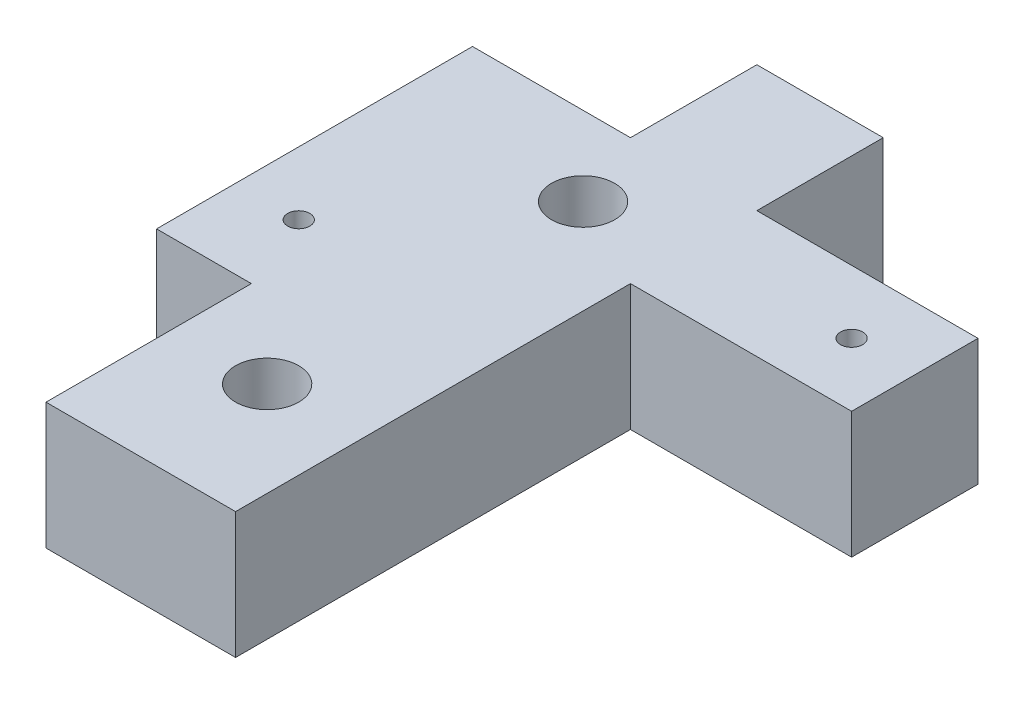
from build123d import *

# Parameters (mm, degrees)
SKETCH_1_W          = 16
SKETCH_1_H          = 23
SKETCH_1_R          = 0.35
EXTRUDE_1_DEPTH     = 4
SKETCH_2_R          = 1
CUT_EXTRUDE_1_DEPTH = 29.301943396
SKETCH_3_R          = 1.5
CUT_EXTRUDE_2_DEPTH = 2
SKETCH_4_W          = 6
SKETCH_4_H          = 2.5
SKETCH_4_W_2        = 7
SKETCH_4_H_2        = 4
SKETCH_4_W_3        = 5
CUT_EXTRUDE_3_DEPTH = 29.301943396


with BuildPart() as part:
    # 草图1 → 凸台-拉伸1 (new body)
    with BuildSketch(Plane(origin=(0, 0, 0), x_dir=(1, 0, 0), z_dir=(0, 1, 0))):
        with Locations((8, -11.5)):
            Rectangle(SKETCH_1_W, SKETCH_1_H)
        with Locations(Location((14, -6, 0), (0, 0, 270))):
            Circle(SKETCH_1_R, mode=Mode.SUBTRACT)
        with Locations(Location((2, -11.5, 0), (0, 0, 270))):
            Circle(SKETCH_1_R, mode=Mode.SUBTRACT)
    extrude(amount=EXTRUDE_1_DEPTH)

    # 草图2 → 切除-拉伸1 (cut, through all)
    with BuildSketch(Plane.XZ):
        with Locations(Location((6, 16.5, 0), (0, 0, 270))):
            Circle(SKETCH_2_R)
        with Locations(Location((6, 6.5, 0), (0, 0, 270))):
            Circle(SKETCH_2_R)
    extrude(amount=-CUT_EXTRUDE_1_DEPTH, mode=Mode.SUBTRACT)

    # 草图3 → 切除-拉伸2 (cut)
    with BuildSketch(Plane.XZ):
        with Locations(Location((6, 16.5, 0), (0, 0, 270))):
            Circle(SKETCH_3_R)
        with Locations(Location((6, 6.5, 0), (0, 0, 270))):
            Circle(SKETCH_3_R)
    extrude(amount=-CUT_EXTRUDE_2_DEPTH, mode=Mode.SUBTRACT)

    # 草图4 → 切除-拉伸3 (cut, through all)
    with BuildSketch(Plane.XZ):
        with Locations((6, 21.75)):
            Rectangle(SKETCH_4_W, SKETCH_4_H)
        Polygon((3, 23), (0, 23), (0, 14), (3, 14), (3, 20.5), align=None)
        Polygon((16, 23), (9, 23), (9, 20.5), (9, 8), (16, 8), align=None)
        with Locations((12.5, 2)):
            Rectangle(SKETCH_4_W_2, SKETCH_4_H_2)
        with Locations((2.5, 2)):
            Rectangle(SKETCH_4_W_3, SKETCH_4_H_2)
    extrude(amount=-CUT_EXTRUDE_3_DEPTH, mode=Mode.SUBTRACT)


solid = part.part
